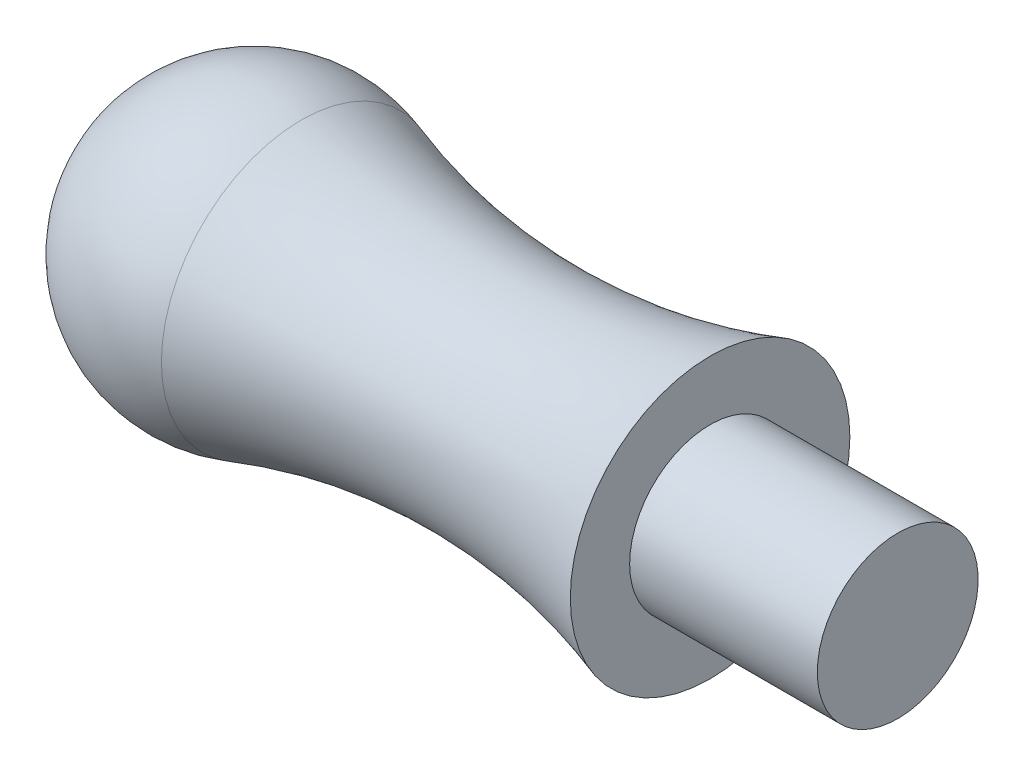
from build123d import *


with BuildPart() as part:
    # Sketch1 → Revolve1 (revolve)
    with BuildSketch(Plane.XY, mode=Mode.PRIVATE) as revolve1_sk:
        with BuildLine():
            Line((17, 5.21494699), (17, 3))
            Line((17, 3), (24, 3))
            Line((24, 3), (24, 0))
            Line((24, 0), (-5.5, 0))
            ThreePointArc((-5.5, 0), (-3.212308396, 4.464423229), (1.747663551, 5.21494699))
            ThreePointArc((1.747663551, 5.21494699), (9.373831776, 3.971079311), (17, 5.21494699))
        make_face()
    revolve(revolve1_sk.sketch.rotate(Axis((0, 0, 0), (1, 0, 0)), 90), axis=Axis((0, 0, 0), (1, 0, 0)))


solid = part.part
